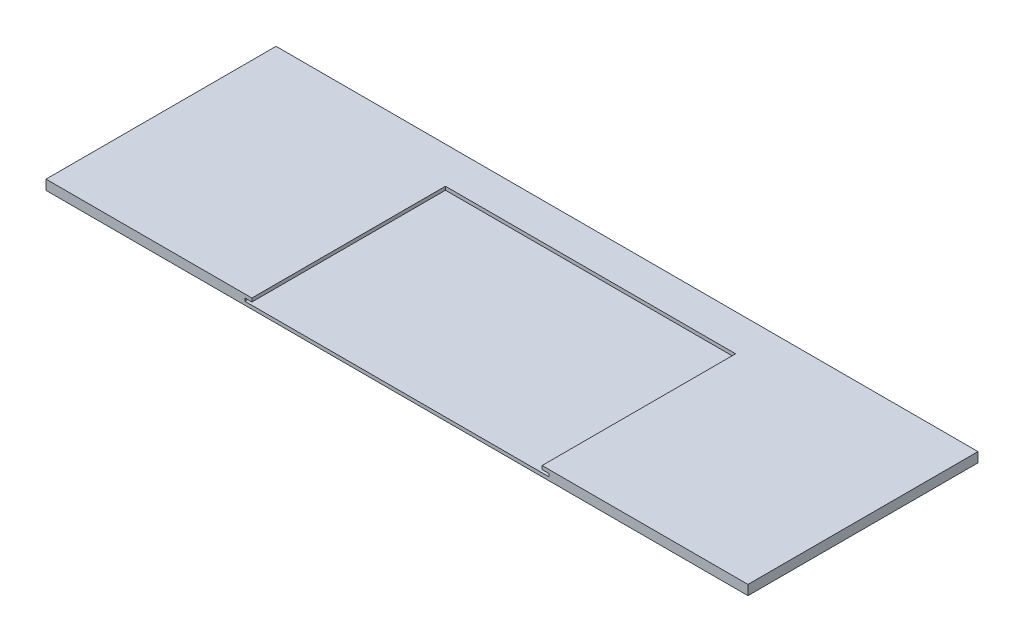
from build123d import *

# Parameters (mm, degrees)
SKETCH1_W           = 202
SKETCH1_H           = 66.2
BOSS_EXTRUDE1_DEPTH = 1
BOSS_EXTRUDE2_DEPTH = 1.816115501
BOSS_EXTRUDE3_DEPTH = 1


with BuildPart() as part:
    # Sketch1 → Boss-Extrude1 (new body)
    with BuildSketch(Plane(origin=(0, 0, 0), x_dir=(1, 0, 0), z_dir=(0, 1, 0))):
        Rectangle(SKETCH1_W, SKETCH1_H)
    extrude(amount=-BOSS_EXTRUDE1_DEPTH)

    # Sketch1<3> → Boss-Extrude2 (add)
    with BuildSketch(Plane(origin=(0, 0, 0), x_dir=(1, 0, 0), z_dir=(0, 1, 0))):
        Polygon((-101, -33.1), (-43.75, -33.1), (-43.75, 24.6), (43.75, 24.6), (43.75, -33.1), (101, -33.1), (101, 33.1), (-101, 33.1), align=None)
    extrude(amount=BOSS_EXTRUDE2_DEPTH)

    # Sketch2 → Boss-Extrude3 (add)
    with BuildSketch(Plane(origin=(0, 1.816115501, 0), x_dir=(1, 0, 0), z_dir=(0, 1, 0))):
        Polygon((-43.75, -33.1), (-41.75, -33.1), (-41.75, 22.6), (41.75, 22.6), (41.75, -33.1), (43.75, -33.1), (43.75, 24.6), (-43.75, 24.6), align=None)
    extrude(amount=-BOSS_EXTRUDE3_DEPTH)


solid = part.part
